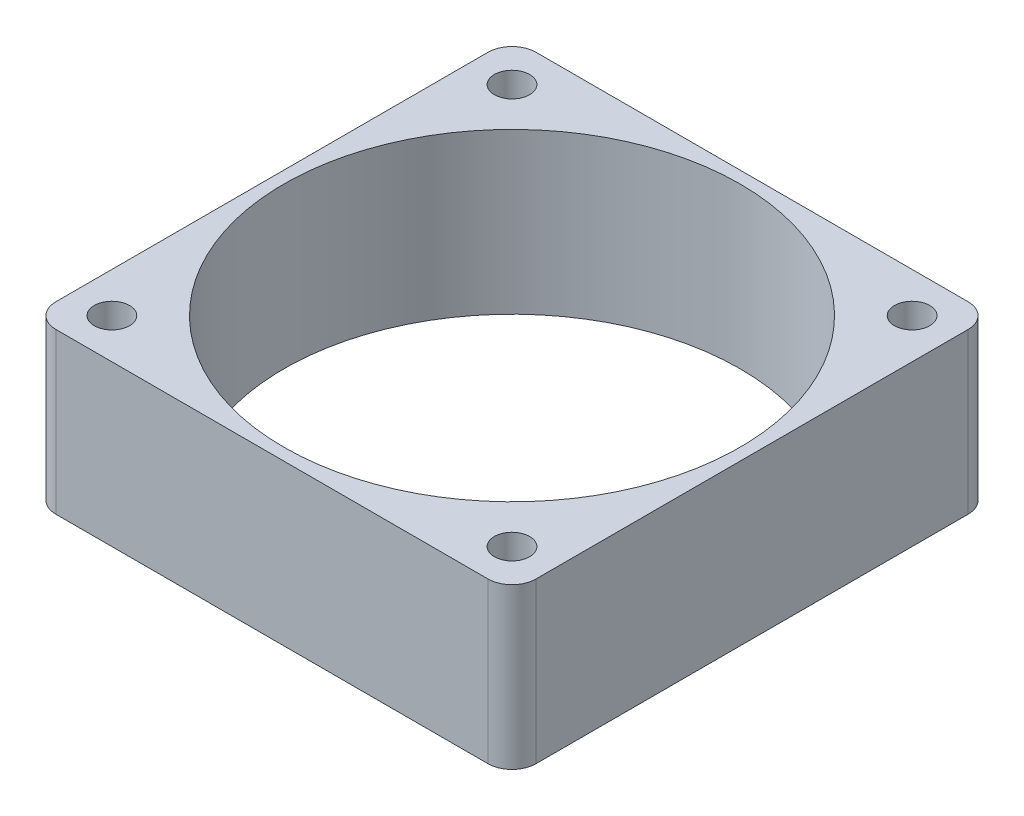
from build123d import *

# Parameters (mm, degrees)
SKETCH1_W           = 60
SKETCH1_H           = 60
SKETCH1_R           = 2.2
SKETCH1_R_2         = 28.5
BOSS_EXTRUDE1_DEPTH = 20
FILLET1_R           = 3


with BuildPart() as part:
    # Sketch1 → Boss-Extrude1 (new body)
    with BuildSketch(Plane(origin=(0, 0, 0), x_dir=(1, 0, 0), z_dir=(0, 1, 0))):
        with Locations((30, -30)):
            Rectangle(SKETCH1_W, SKETCH1_H)
        with Locations(Location((5, -55, 0), (0, 0, 270))):
            Circle(SKETCH1_R, mode=Mode.SUBTRACT)
        with Locations(Location((55, -55, 0), (0, 0, 270))):
            Circle(SKETCH1_R, mode=Mode.SUBTRACT)
        with Locations(Location((55, -5, 0), (0, 0, 270))):
            Circle(SKETCH1_R, mode=Mode.SUBTRACT)
        with Locations(Location((5, -5, 0), (0, 0, 270))):
            Circle(SKETCH1_R, mode=Mode.SUBTRACT)
        with Locations(Location((30, -30, 0), (0, 0, 270))):
            Circle(SKETCH1_R_2, mode=Mode.SUBTRACT)
    extrude(amount=BOSS_EXTRUDE1_DEPTH)

    # Fillet1
    fillet1_edges = [part.edges().sort_by_distance(p)[0] for p in [
        (0, 10, 0),
        (60, 10, 0),
        (60, 10, 60),
        (0, 10, 60),
    ]]
    fillet(fillet1_edges, radius=FILLET1_R)


solid = part.part
